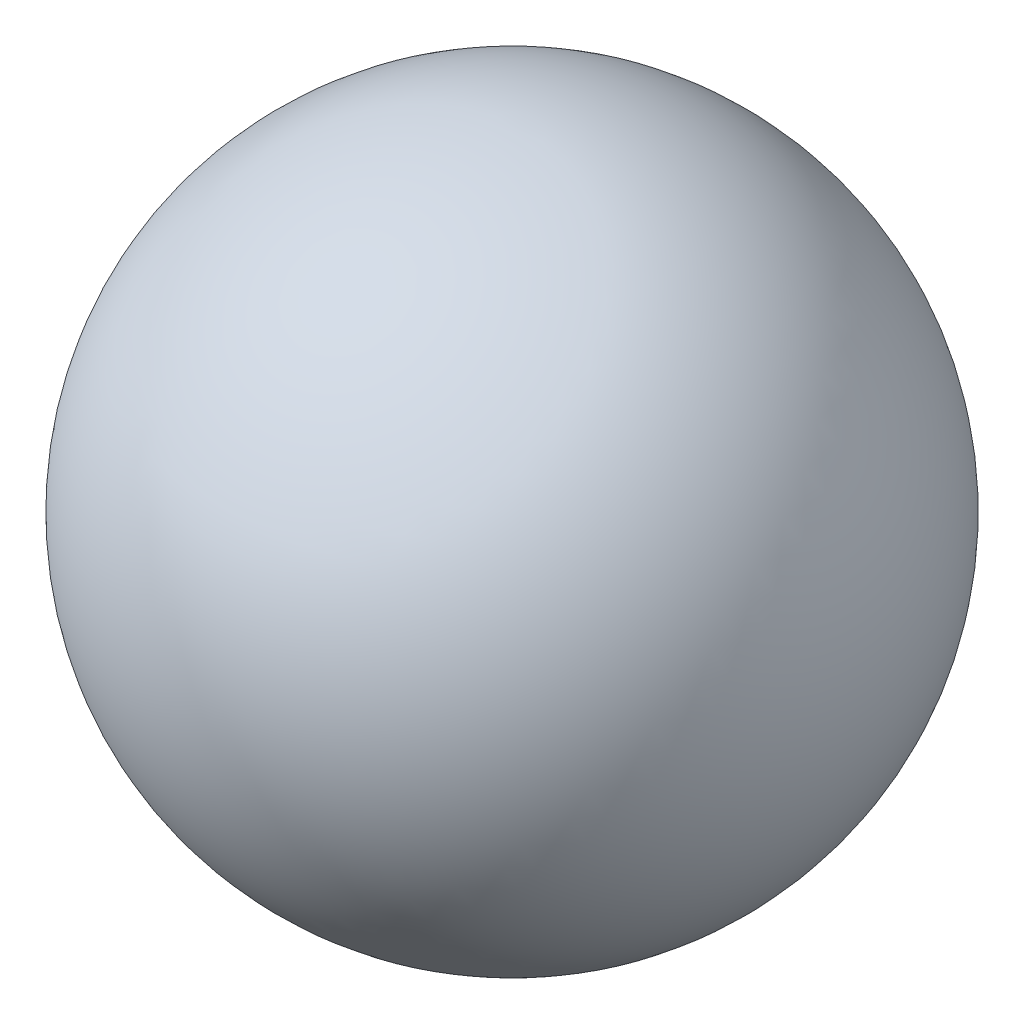
from build123d import *


with BuildPart() as part:
    # 草图1 → 旋转1 (revolve)
    with BuildSketch(Plane.XY):
        with BuildLine():
            Line((73.75, 17.5), (73.75, -17.5))
            ThreePointArc((73.75, -17.5), (91.25, 0), (73.75, 17.5))
        make_face()
    revolve(axis=Axis((73.75, 23.456254129, 0), (0, -1, 0)))


solid = part.part
